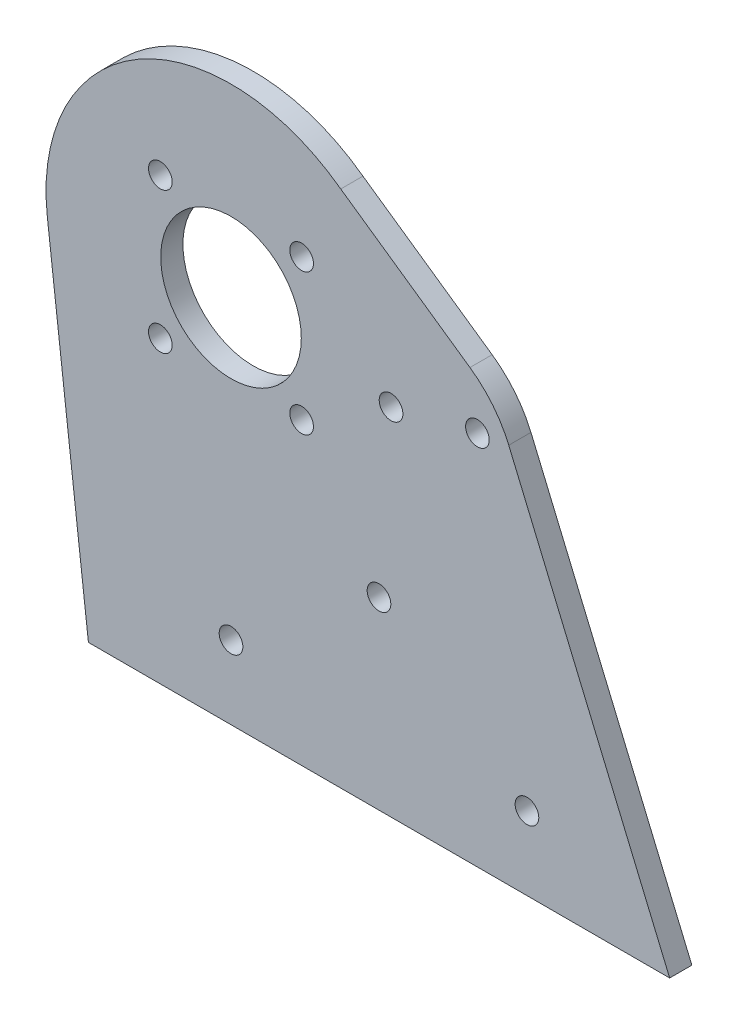
from build123d import *

# Parameters (mm, degrees)
SKETCH_1_R          = 1.6
SKETCH_1_R_2        = 8
EXTRUDE_1_DEPTH     = 3
SKETCH_2_R          = 9.5
CUT_EXTRUDE_1_DEPTH = 10


with BuildPart() as part:
    # 草图1 → 凸台-拉伸1 (new body)
    with BuildSketch(Plane.XY):
        with BuildLine():
            Line((27.996813697, 12.530864127), (49.744946635, -38.957900319))
            Line((49.744946635, -38.957900319), (-28.813781546, -38.957900319))
            Line((-28.813781546, -38.957900319), (-34.369737997, 8.111506623))
            ThreePointArc((-34.369737997, 8.111506623), (-22.106553261, 32.655394345), (5.290025786, 31.166911584))
            Line((5.290025786, 31.166911584), (22.752678609, 19.002490435))
            ThreePointArc((22.752678609, 19.002490435), (25.832973998, 16.137991786), (27.996813697, 12.530864127))
        make_face()
        with Locations((-19.091881546, 20.591881546)):
            Circle(SKETCH_1_R, mode=Mode.SUBTRACT)
        with Locations((-19.09157413, 1.492010657)):
            Circle(SKETCH_1_R, mode=Mode.SUBTRACT)
        with Locations((0, 1.5)):
            Circle(SKETCH_1_R, mode=Mode.SUBTRACT)
        with Locations((0.000307159, 20.583891946)):
            Circle(SKETCH_1_R, mode=Mode.SUBTRACT)
        with Locations((-9.542099681, 11.042099681)):
            Circle(SKETCH_1_R_2, mode=Mode.SUBTRACT)
        with Locations((10.457900319, -14.042678355)):
            Circle(SKETCH_1_R, mode=Mode.SUBTRACT)
        with Locations((30.457900319, -29.042678355)):
            Circle(SKETCH_1_R, mode=Mode.SUBTRACT)
        with Locations((-9.542099681, -29.042678355)):
            Circle(SKETCH_1_R, mode=Mode.SUBTRACT)
        with Locations((23.762798875, 11.821649257)):
            Circle(SKETCH_1_R, mode=Mode.SUBTRACT)
        with Locations((12.088647332, 9.044206953)):
            Circle(SKETCH_1_R, mode=Mode.SUBTRACT)
    extrude(amount=EXTRUDE_1_DEPTH)

    # 草图2 → 切除-拉伸1 (cut)
    with BuildSketch(Plane.XY.offset(3)):
        with Locations((-9.542099681, 11.042099681)):
            Circle(SKETCH_2_R)
    extrude(amount=-CUT_EXTRUDE_1_DEPTH, mode=Mode.SUBTRACT)


solid = part.part
